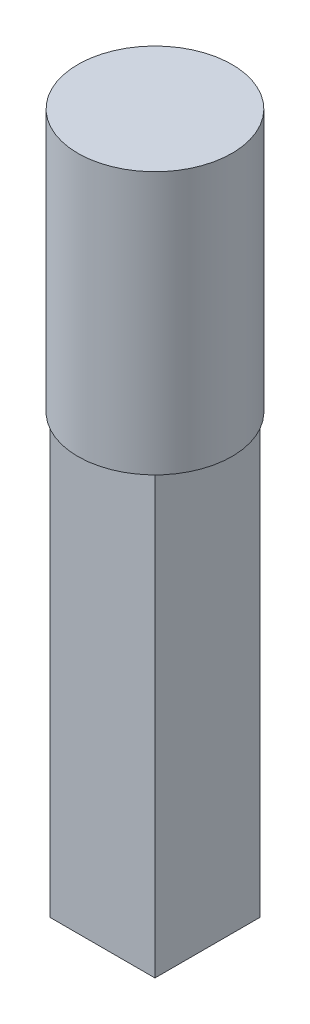
from build123d import *

# Parameters (mm, degrees)
SKETCH_1_W      = 60
SKETCH_1_H      = 60
EXTRUDE_1_DEPTH = 250
SKETCH_2_R      = 44
EXTRUDE_2_DEPTH = 150


with BuildPart() as part:
    # 草图1 → 凸台-拉伸1 (new body)
    with BuildSketch(Plane(origin=(0, 0, 0), x_dir=(1, 0, 0), z_dir=(0, 1, 0))):
        Rectangle(SKETCH_1_W, SKETCH_1_H)
    extrude(amount=EXTRUDE_1_DEPTH)

    # 草图2 → 凸台-拉伸2 (add)
    with BuildSketch(Plane(origin=(0, 250, 0), x_dir=(1, 0, 0), z_dir=(0, 1, 0))):
        with Locations(Location((0, 0, 0), (0, 0, 270))):
            Circle(SKETCH_2_R)
    extrude(amount=EXTRUDE_2_DEPTH)


solid = part.part
